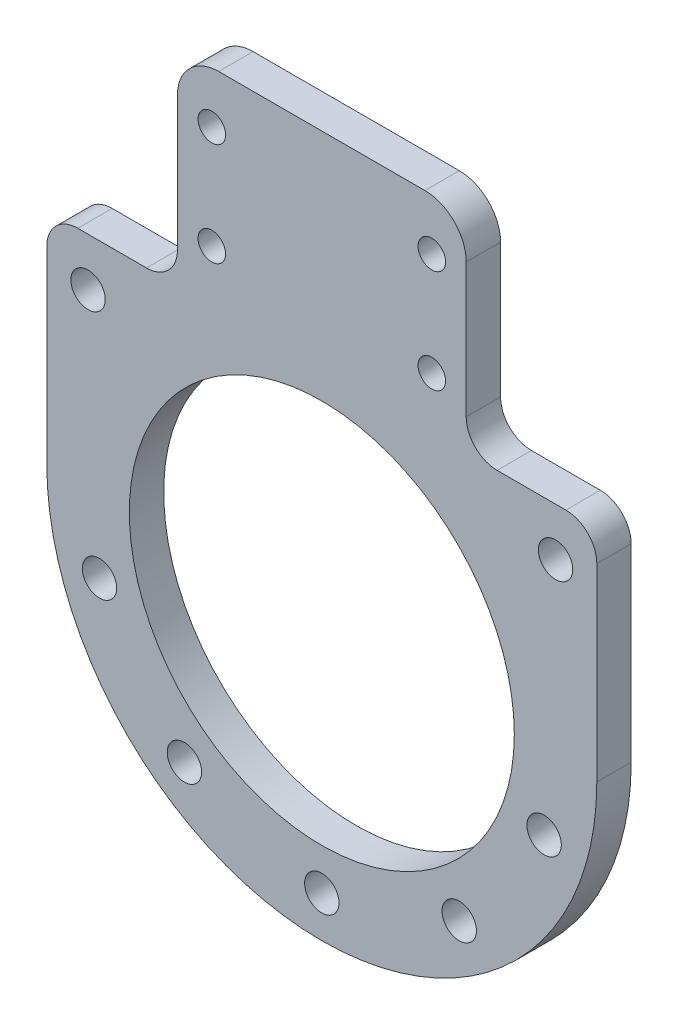
from build123d import *

# Parameters (mm, degrees)
EXTRUDE_1_DEPTH     = 5
SKETCH_2_R          = 28
CUT_EXTRUDE_1_DEPTH = 91.840456458
SKETCH_3_W          = 19
SKETCH_3_H          = 30
CUT_EXTRUDE_2_DEPTH = 91.840456458
FILLET_2_R          = 4.5
SKETCH_4_W          = 19
SKETCH_4_H          = 30
CUT_EXTRUDE_3_DEPTH = 5
FILLET_3_R          = 4.5
SKETCH_6_R          = 2.5
CUT_EXTRUDE_5_DEPTH = 91.840456458
FILLET_4_R          = 6
SKETCH_7_R          = 2.5
CUT_EXTRUDE_6_DEPTH = 91.840456458
SKETCH_8_R          = 2
CUT_EXTRUDE_7_DEPTH = 91.840456458


with BuildPart() as part:
    # 草图1 → 凸台-拉伸1 (new body)
    with BuildSketch(Plane.XY):
        with BuildLine():
            Line((-26, 29.123470654), (54, 29.123470654))
            Line((54, 29.123470654), (54, -32.876529346))
            ThreePointArc((54, -32.876529346), (14, -72.876529346), (-26, -32.876529346))
            Line((-26, -32.876529346), (-26, 29.123470654))
        make_face()
    extrude(amount=EXTRUDE_1_DEPTH)

    # 草图2 → 切除-拉伸1 (cut, through all)
    with BuildSketch(Plane.XY.offset(5)):
        with Locations((14, -32.876529346)):
            Circle(SKETCH_2_R)
    extrude(amount=-CUT_EXTRUDE_1_DEPTH, mode=Mode.SUBTRACT)

    # 草图3 → 切除-拉伸2 (cut, through all)
    with BuildSketch(Plane.XY.offset(5)):
        with Locations((44.5, 14.123470654)):
            Rectangle(SKETCH_3_W, SKETCH_3_H)
    extrude(amount=-CUT_EXTRUDE_2_DEPTH, mode=Mode.SUBTRACT)

    # 圆角2
    fillet_2_edges = [part.edges().sort_by_distance(p)[0] for p in [
        (54, -0.876529346, 2.5),
        (35, -0.876529346, 2.5),
    ]]
    fillet(fillet_2_edges, radius=FILLET_2_R)

    # 草图4 → 切除-拉伸3 (cut)
    with BuildSketch(Plane.XY.offset(5)):
        with Locations((-16.5, 14.123470654)):
            Rectangle(SKETCH_4_W, SKETCH_4_H)
    extrude(amount=-CUT_EXTRUDE_3_DEPTH, mode=Mode.SUBTRACT)

    # 圆角3
    fillet_3_edges = [part.edges().sort_by_distance(p)[0] for p in [
        (-26, -0.876529346, 2.5),
        (-7, -0.876529346, 2.5),
    ]]
    fillet(fillet_3_edges, radius=FILLET_3_R)

    # 草图6 → 切除-拉伸5 (cut, through all)
    with BuildSketch(Plane.XY.offset(5)):
        with Locations((-20, -7.876529346)):
            Circle(SKETCH_6_R)
        with Locations((48, -7.876529346)):
            Circle(SKETCH_6_R)
    extrude(amount=-CUT_EXTRUDE_5_DEPTH, mode=Mode.SUBTRACT)

    # 圆角4
    fillet_4_edges = [part.edges().sort_by_distance(p)[0] for p in [
        (35, 29.123470654, 2.5),
        (-7, 29.123470654, 2.5),
    ]]
    fillet(fillet_4_edges, radius=FILLET_4_R)

    # 草图7 → 切除-拉伸6 (cut, through all)
    with BuildSketch(Plane.XY.offset(5)):
        with Locations((14, -66.876529346)):
            Circle(SKETCH_7_R)
        with Locations((-5.984698578, -60.383107155)):
            Circle(SKETCH_7_R)
        with Locations((-18.335921554, -43.383107155)):
            Circle(SKETCH_7_R)
        with Locations((46.335921554, -43.383107155)):
            Circle(SKETCH_7_R)
        with Locations((33.984698578, -60.383107155)):
            Circle(SKETCH_7_R)
    extrude(amount=-CUT_EXTRUDE_6_DEPTH, mode=Mode.SUBTRACT)

    # 草图8 → 切除-拉伸7 (cut, through all)
    with BuildSketch(Plane.XY.offset(5)):
        with Locations((-2, 6.623470654)):
            Circle(SKETCH_8_R)
        with Locations((-2, 21.623470654)):
            Circle(SKETCH_8_R)
        with Locations((30, 21.623470654)):
            Circle(SKETCH_8_R)
        with Locations((30, 6.623470654)):
            Circle(SKETCH_8_R)
    extrude(amount=-CUT_EXTRUDE_7_DEPTH, mode=Mode.SUBTRACT)


solid = part.part
